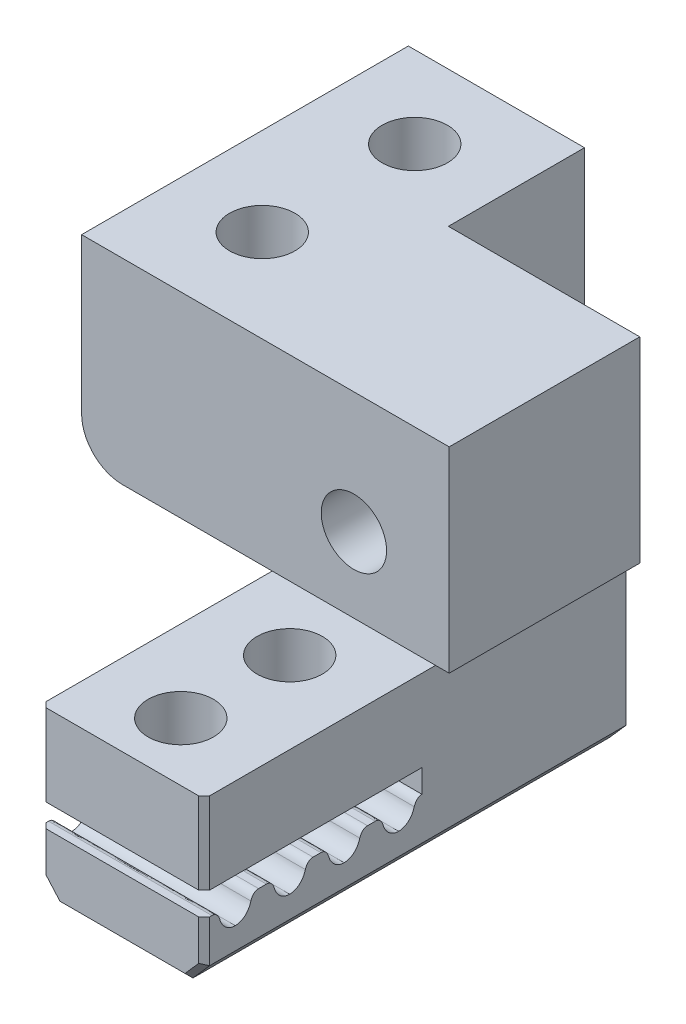
from build123d import *

# Parameters (mm, degrees)
BOSS_EXTRUDE1_DEPTH     = 13
SKETCH6_W               = 6
SKETCH6_H               = 5
BOSS_EXTRUDE4_DEPTH     = 5.6
SKETCH16_W              = 6
SKETCH16_H              = 8
BOSS_EXTRUDE5_DEPTH     = 0.1
CUT_EXTRUDE6_DEPTH      = 4
CUT_EXTRUDE6_DEPTH_BACK = 3.6
SKETCH15_R              = 1.2
CUT_EXTRUDE7_DEPTH      = 8.7202
CUT_EXTRUDE8_START      = -0.2202
SKETCH19_W              = 6
SKETCH19_H              = 8
SKETCH19_R              = 1.2
CUT_EXTRUDE8_DEPTH      = 0.2202
SKETCH12_R              = 1.2
CUT_EXTRUDE5_DEPTH      = 6
SKETCH21_R              = 1.2
BOSS_EXTRUDE6_DEPTH     = 2.5
SKETCH24_W              = 6
SKETCH24_H              = 5.5
CUT_EXTRUDE10_DEPTH     = 8.5
BOSS_EXTRUDE8_DEPTH     = 7.2
FILLET4_R               = 1.5
SKETCH26_R              = 1.2
CUT_EXTRUDE11_DEPTH     = 10
CHAMFER1_SIZE           = 0.2
BOSS_EXTRUDE9_DEPTH     = 5
SKETCH31_R              = 1.2
CUT_EXTRUDE12_DEPTH     = 8


with BuildPart() as part:
    # Sketch1 → Boss-Extrude1 (new body)
    with BuildSketch(Plane.XY):
        Polygon((3, 3.05), (3, -2.253801214), (2.388188946, -2.95), (-2.388188946, -2.95), (-3, -2.253801214), (-3, 3.05), align=None)
    extrude(amount=BOSS_EXTRUDE1_DEPTH)

    # Sketch6 → Boss-Extrude4 (add)
    with BuildSketch(Plane(origin=(0, 3.05, 0), x_dir=(1, 0, 0), z_dir=(0, 1, 0))):
        with Locations((0, -2.5)):
            Rectangle(SKETCH6_W, SKETCH6_H)
    extrude(amount=BOSS_EXTRUDE4_DEPTH)

    # Sketch16 → Boss-Extrude5 (add)
    with BuildSketch(Plane(origin=(0, 3.05, 0), x_dir=(1, 0, 0), z_dir=(0, 1, 0))):
        with Locations((0, -9)):
            Rectangle(SKETCH16_W, SKETCH16_H)
    extrude(amount=BOSS_EXTRUDE5_DEPTH)

    # Sketch18 → Cut-Extrude6 (cut, two sides: drawn at the far end of the back side and taken through both)
    with BuildSketch(Plane(origin=(0, 0, 0), x_dir=(0, 0, -1), z_dir=(1, 0, 0)).offset(-CUT_EXTRUDE6_DEPTH_BACK)):
        with BuildLine():
            Line((-8.8572, -0.0702), (-12.8572, -0.0702))
            Line((-12.8572, -0.0702), (-13, -0.0702))
            Line((-13, -0.0702), (-13, -0.7))
            Line((-13, -0.7), (-12.8572, -0.7))
            Line((-12.8572, -0.7), (-12.7144, -0.7))
            add(Edge.make_bspline(
                [(-12.7144, -0.7), (-12.5198, -0.7), (-12.43, -0.9509)],
                knots=[0.103448276, 0.103448276, 0.103448276, 0.137931034, 0.137931034, 0.137931034], degree=2))
            add(Edge.make_bspline(
                [(-12.43, -0.9509), (-12.3594, -1.2388), (-12.13, -1.45), (-11.8572, -1.45)],
                knots=[0.137931034, 0.137931034, 0.137931034, 0.137931034, 0.172413793, 0.172413793, 0.172413793, 0.172413793], degree=3))
            add(Edge.make_bspline(
                [(-11.8572, -1.45), (-11.5844, -1.45), (-11.355, -1.2388), (-11.2844, -0.9509)],
                knots=[0.172413793, 0.172413793, 0.172413793, 0.172413793, 0.206896552, 0.206896552, 0.206896552, 0.206896552], degree=3))
            add(Edge.make_bspline(
                [(-11.2844, -0.9509), (-11.1946, -0.7), (-11, -0.7)],
                knots=[0.206896552, 0.206896552, 0.206896552, 0.24137931, 0.24137931, 0.24137931], degree=2))
            Line((-11, -0.7), (-10.8572, -0.7))
            Line((-10.8572, -0.7), (-10.7144, -0.7))
            add(Edge.make_bspline(
                [(-10.7144, -0.7), (-10.5198, -0.7), (-10.43, -0.9509)],
                knots=[0.310344828, 0.310344828, 0.310344828, 0.344827586, 0.344827586, 0.344827586], degree=2))
            add(Edge.make_bspline(
                [(-10.43, -0.9509), (-10.3594, -1.2388), (-10.13, -1.45), (-9.8572, -1.45)],
                knots=[0.344827586, 0.344827586, 0.344827586, 0.344827586, 0.379310345, 0.379310345, 0.379310345, 0.379310345], degree=3))
            add(Edge.make_bspline(
                [(-9.8572, -1.45), (-9.5844, -1.45), (-9.355, -1.2388), (-9.2844, -0.9509)],
                knots=[0.379310345, 0.379310345, 0.379310345, 0.379310345, 0.413793103, 0.413793103, 0.413793103, 0.413793103], degree=3))
            add(Edge.make_bspline(
                [(-9.2844, -0.9509), (-9.1946, -0.7), (-9, -0.7)],
                knots=[0.413793103, 0.413793103, 0.413793103, 0.448275862, 0.448275862, 0.448275862], degree=2))
            Line((-9, -0.7), (-8.8572, -0.7))
            Line((-8.8572, -0.7), (-8.7144, -0.7))
            add(Edge.make_bspline(
                [(-8.7144, -0.7), (-8.5198, -0.7), (-8.43, -0.9509)],
                knots=[0.517241379, 0.517241379, 0.517241379, 0.551724138, 0.551724138, 0.551724138], degree=2))
            add(Edge.make_bspline(
                [(-8.43, -0.9509), (-8.3594, -1.2388), (-8.13, -1.45), (-7.8572, -1.45)],
                knots=[0.551724138, 0.551724138, 0.551724138, 0.551724138, 0.586206897, 0.586206897, 0.586206897, 0.586206897], degree=3))
            add(Edge.make_bspline(
                [(-7.8572, -1.45), (-7.5844, -1.45), (-7.355, -1.2388), (-7.2844, -0.9509)],
                knots=[0.586206897, 0.586206897, 0.586206897, 0.586206897, 0.620689655, 0.620689655, 0.620689655, 0.620689655], degree=3))
            add(Edge.make_bspline(
                [(-7.2844, -0.9509), (-7.1946, -0.7), (-7, -0.7)],
                knots=[0.620689655, 0.620689655, 0.620689655, 0.655172414, 0.655172414, 0.655172414], degree=2))
            Line((-7, -0.7), (-6.8572, -0.7))
            Line((-6.8572, -0.7), (-6.7144, -0.7))
            add(Edge.make_bspline(
                [(-6.7144, -0.7), (-6.5198, -0.7), (-6.43, -0.9509)],
                knots=[0.724137931, 0.724137931, 0.724137931, 0.75862069, 0.75862069, 0.75862069], degree=2))
            add(Edge.make_bspline(
                [(-6.43, -0.9509), (-6.3594, -1.2388), (-6.13, -1.45), (-5.8572, -1.45)],
                knots=[0.75862069, 0.75862069, 0.75862069, 0.75862069, 0.793103448, 0.793103448, 0.793103448, 0.793103448], degree=3))
            add(Edge.make_bspline(
                [(-5.8572, -1.45), (-5.5844, -1.45), (-5.355, -1.2388), (-5.2844, -0.9509)],
                knots=[0.793103448, 0.793103448, 0.793103448, 0.793103448, 0.827586207, 0.827586207, 0.827586207, 0.827586207], degree=3))
            add(Edge.make_bspline(
                [(-5.2844, -0.9509), (-5.1946, -0.7), (-5, -0.7)],
                knots=[0.827586207, 0.827586207, 0.827586207, 0.862068966, 0.862068966, 0.862068966], degree=2))
            Line((-5, -0.7), (-5, -0.0702))
            Line((-5, -0.0702), (-8.8572, -0.0702))
        make_face()
    extrude(amount=CUT_EXTRUDE6_DEPTH + CUT_EXTRUDE6_DEPTH_BACK, mode=Mode.SUBTRACT)

    # Sketch15 → Cut-Extrude7 (cut)
    with BuildSketch(Plane(origin=(0, 8.65, 0), x_dir=(1, 0, 0), z_dir=(0, 1, 0))):
        with Locations(Location((0, -10.8572, 0), (0, 0, 180))):
            Circle(SKETCH15_R)
        with Locations(Location((0, -6.8572, 0), (0, 0, 180))):
            Circle(SKETCH15_R)
    extrude(amount=-CUT_EXTRUDE7_DEPTH, mode=Mode.SUBTRACT)

    # Sketch19 → Cut-Extrude8 (cut)
    with BuildSketch(Plane.XZ.offset(0.0702).offset(CUT_EXTRUDE8_START)):
        with Locations((0, 9)):
            Rectangle(SKETCH19_W, SKETCH19_H)
        with Locations(Location((0, 10.8572, 0), (0, 0, 180))):
            Circle(SKETCH19_R, mode=Mode.SUBTRACT)
        with Locations(Location((0, 6.8572, 0), (0, 0, 180))):
            Circle(SKETCH19_R, mode=Mode.SUBTRACT)
    extrude(amount=CUT_EXTRUDE8_DEPTH, mode=Mode.SUBTRACT)

    # Sketch12 → Cut-Extrude5 (cut)
    with BuildSketch(Plane.XY.offset(5)):
        with Locations((0, 5.85)):
            Circle(SKETCH12_R)
    extrude(amount=-CUT_EXTRUDE5_DEPTH, mode=Mode.SUBTRACT)

    # Sketch21 → Boss-Extrude6 (add)
    with BuildSketch(Plane(origin=(0, 0, 0), x_dir=(-1, 0, 0), z_dir=(0, 0, -1))):
        Polygon((-2.388188946, -2.95), (2.388188946, -2.95), (3, -2.253801214), (3, 8.65), (-3, 8.65), (-3, -2.253801214), align=None)
        with Locations(Location((0, 5.85, 0), (0, 0, 180))):
            Circle(SKETCH21_R, mode=Mode.SUBTRACT)
    extrude(amount=BOSS_EXTRUDE6_DEPTH)

    # Sketch24 → Cut-Extrude10 (cut)
    with BuildSketch(Plane.XY.offset(5)):
        with Locations((0, 5.9)):
            Rectangle(SKETCH24_W, SKETCH24_H)
    extrude(amount=-CUT_EXTRUDE10_DEPTH, mode=Mode.SUBTRACT)

    # Sketch25 → Boss-Extrude8 (add)
    with BuildSketch(Plane(origin=(0, 3.15, 0), x_dir=(1, 0, 0), z_dir=(0, 1, 0))):
        Polygon((-10, -4.5), (0, -4.5), (3.5, -4.5), (3.5, 2.5), (-10, 2.5), align=None)
    extrude(amount=BOSS_EXTRUDE8_DEPTH)

    # Fillet4
    fillet4_edges = [part.edges().sort_by_distance(p)[0] for p in [
        (-10, 3.15, 1),
    ]]
    fillet(fillet4_edges, radius=FILLET4_R)

    # Sketch26 → Cut-Extrude11 (cut)
    with BuildSketch(Plane.XY.offset(4.5)):
        with Locations((0, 5.9)):
            Circle(SKETCH26_R)
    extrude(amount=-CUT_EXTRUDE11_DEPTH, mode=Mode.SUBTRACT)

    # Chamfer1
    chamfer1_edges = [part.edges().sort_by_distance(p)[0] for p in [
        (-2.694094473, -2.601900607, 13),
        (0, -2.95, 13),
        (2.694094473, -2.601900607, 13),
        (3, 1.65, 13),
        (3, -1.476900607, 13),
        (-3, -1.476900607, 13),
        (-3, 1.65, 13),
    ]]
    chamfer(chamfer1_edges, length=CHAMFER1_SIZE)

    # Sketch29 → Boss-Extrude9 (add)
    with BuildSketch(Plane(origin=(0, 0, -2.5), x_dir=(-1, 0, 0), z_dir=(0, 0, -1))):
        with BuildLine():
            Line((3.53, 3.15), (3.53, 10.35))
            Line((3.53, 10.35), (10, 10.35))
            Line((10, 10.35), (10, 4.65))
            ThreePointArc((10, 4.65), (9.560660172, 3.589339828), (8.5, 3.15))
            Line((8.5, 3.15), (3.53, 3.15))
        make_face()
    extrude(amount=BOSS_EXTRUDE9_DEPTH)

    # Sketch31 → Cut-Extrude12 (cut)
    with BuildSketch(Plane(origin=(0, 10.35, 0), x_dir=(1, 0, 0), z_dir=(0, 1, 0))):
        with Locations(Location((-6.765, 4.5, 0), (0, 0, 180))):
            Circle(SKETCH31_R)
        with Locations(Location((-6.765, -1.1, 0), (0, 0, 180))):
            Circle(SKETCH31_R)
    extrude(amount=-CUT_EXTRUDE12_DEPTH, mode=Mode.SUBTRACT)


solid = part.part
